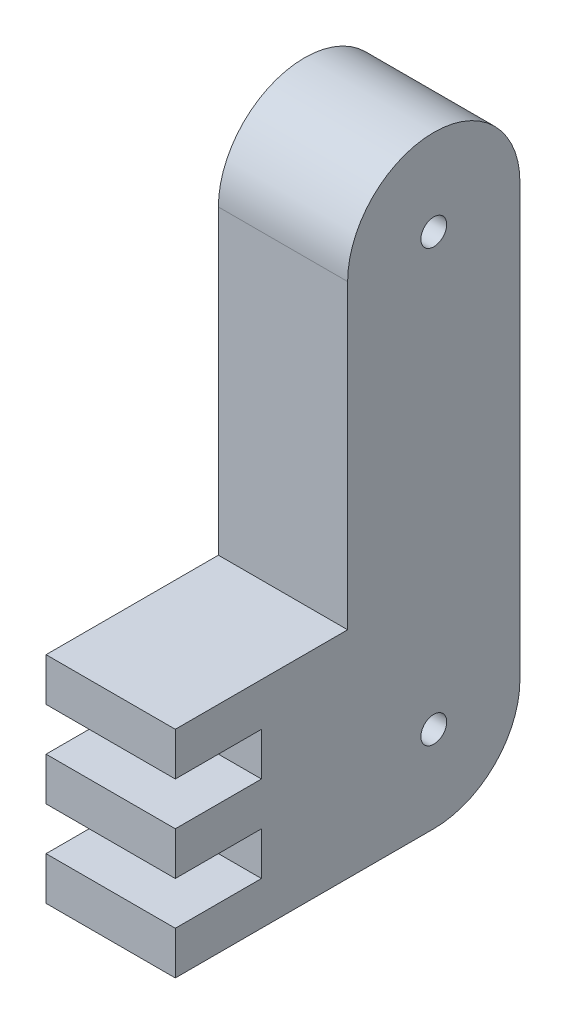
from build123d import *

# Parameters (mm, degrees)
SKETCH1_R           = 1.5
BOSS_EXTRUDE1_DEPTH = 15
SKETCH2_W           = 10
SKETCH2_H           = 5
CUT_EXTRUDE1_DEPTH  = 15


with BuildPart() as part:
    # Sketch1 → Boss-Extrude1 (new body)
    with BuildSketch(Plane(origin=(0, 0, 0), x_dir=(0, 0, -1), z_dir=(1, 0, 0))):
        with BuildLine():
            Line((-10, 15), (-30, 15))
            Line((-30, 15), (-30, -10))
            Line((-30, -10), (0, -10))
            ThreePointArc((0, -10), (7.071067812, -7.071067812), (10, 0))
            Line((10, 0), (10, 50))
            ThreePointArc((10, 50), (0, 60), (-10, 50))
            Line((-10, 50), (-10, 15))
        make_face()
        with Locations((0, 50)):
            Circle(SKETCH1_R, mode=Mode.SUBTRACT)
        Circle(SKETCH1_R, mode=Mode.SUBTRACT)
    extrude(amount=BOSS_EXTRUDE1_DEPTH)

    # Sketch2 → Cut-Extrude1 (cut)
    with BuildSketch(Plane(origin=(15, 0, 0), x_dir=(0, 0, -1), z_dir=(1, 0, 0))):
        with Locations((-25, 7.5)):
            Rectangle(SKETCH2_W, SKETCH2_H)
        with Locations((-25, -2.5)):
            Rectangle(SKETCH2_W, SKETCH2_H)
    extrude(amount=-CUT_EXTRUDE1_DEPTH, mode=Mode.SUBTRACT)


solid = part.part
